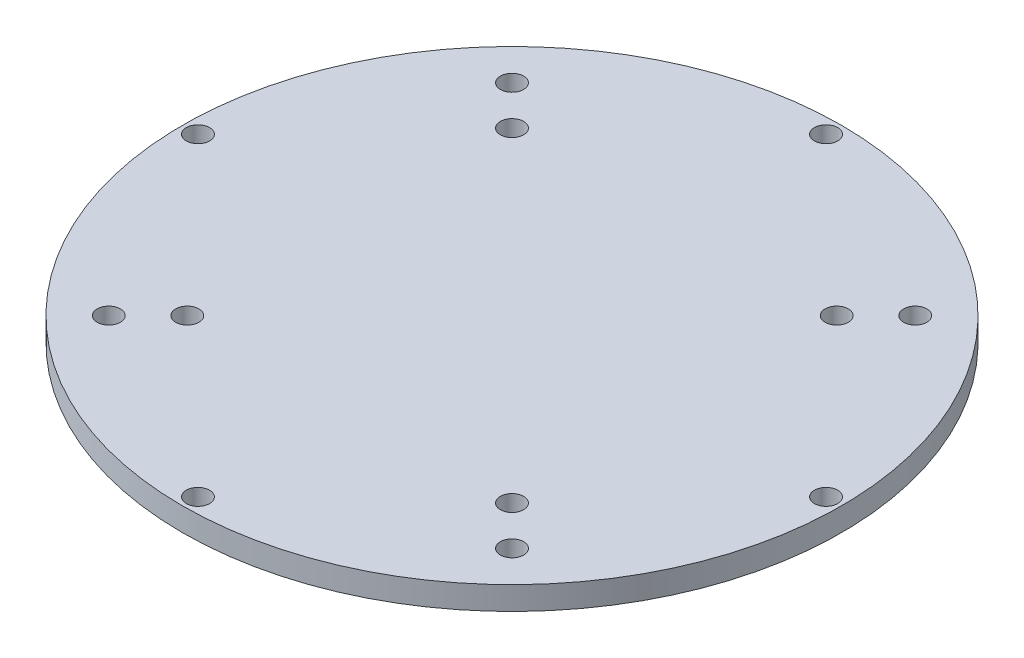
from build123d import *

# Parameters (mm, degrees)
SKETCH_1_R      = 42.5
SKETCH_1_R_2    = 1.5
EXTRUDE_1_DEPTH = 3


with BuildPart() as part:
    # 草图1 → 凸台-拉伸1 (new body)
    with BuildSketch(Plane(origin=(0, 0, 0), x_dir=(1, 0, 0), z_dir=(0, 1, 0))):
        with Locations(Location((0, 0, 0), (0, 0, 270))):
            Circle(SKETCH_1_R)
        with Locations(Location((-26, 26, 0), (0, 0, 270))):
            Circle(SKETCH_1_R_2, mode=Mode.SUBTRACT)
        with Locations(Location((26, 26, 0), (0, 0, 270))):
            Circle(SKETCH_1_R_2, mode=Mode.SUBTRACT)
        with Locations(Location((26, -26, 0), (0, 0, 270))):
            Circle(SKETCH_1_R_2, mode=Mode.SUBTRACT)
        with Locations(Location((-26, -26, 0), (0, 0, 270))):
            Circle(SKETCH_1_R_2, mode=Mode.SUBTRACT)
        with Locations(Location((0, 40.5, 0), (0, 0, 270))):
            Circle(SKETCH_1_R_2, mode=Mode.SUBTRACT)
        with Locations(Location((40.5, 0, 0), (0, 0, 270))):
            Circle(SKETCH_1_R_2, mode=Mode.SUBTRACT)
        with Locations(Location((0, -40.5, 0), (0, 0, 270))):
            Circle(SKETCH_1_R_2, mode=Mode.SUBTRACT)
        with Locations(Location((-40.5, 0, 0), (0, 0, 270))):
            Circle(SKETCH_1_R_2, mode=Mode.SUBTRACT)
        with Locations(Location((-20.937431791, 20.937431791, 0), (0, 0, 270))):
            Circle(SKETCH_1_R_2, mode=Mode.SUBTRACT)
        with Locations(Location((20.937431791, 20.937431791, 0), (0, 0, 270))):
            Circle(SKETCH_1_R_2, mode=Mode.SUBTRACT)
        with Locations(Location((20.937431791, -20.937431791, 0), (0, 0, 270))):
            Circle(SKETCH_1_R_2, mode=Mode.SUBTRACT)
        with Locations(Location((-20.937431791, -20.937431791, 0), (0, 0, 270))):
            Circle(SKETCH_1_R_2, mode=Mode.SUBTRACT)
    extrude(amount=EXTRUDE_1_DEPTH)


solid = part.part
